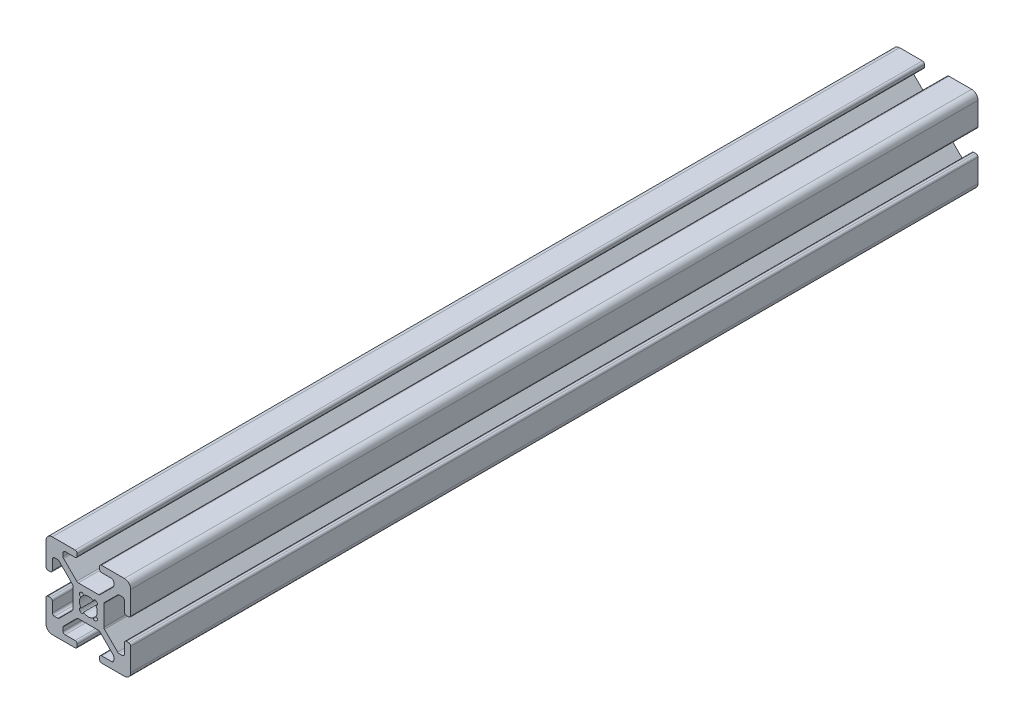
from build123d import *

# Parameters (mm, degrees)
F_2020_PROFILE_DEPTH = 100


with BuildPart() as part:
    # Sketch1 → 2020 Profile (new, symmetric)
    with BuildSketch(Plane.XY):
        with BuildLine():
            Line((-3.655, 0), (-3.655, 2.383919339))
            ThreePointArc((-3.655, 2.383919339), (-3.693669197, 2.578322522), (-3.803789755, 2.743129583))
            Line((-3.803789755, 2.743129583), (-6.906870417, 5.846210245))
            ThreePointArc((-6.906870417, 5.846210245), (-7.071677478, 5.956330803), (-7.266080661, 5.995))
            Line((-7.266080661, 5.995), (-7.992, 5.995))
            ThreePointArc((-7.992, 5.995), (-8.351210245, 5.846210245), (-8.5, 5.487))
            Line((-8.5, 5.487), (-8.5, 3.138))
            ThreePointArc((-8.5, 3.138), (-8.648789755, 2.778789755), (-9.008, 2.63))
            Line((-9.008, 2.63), (-9.492, 2.63))
            ThreePointArc((-9.492, 2.63), (-9.851210245, 2.778789755), (-10, 3.138))
            Line((-10, 3.138), (-10, 8.5))
            ThreePointArc((-10, 8.5), (-9.560660172, 9.560660172), (-8.5, 10))
            Line((-8.5, 10), (-3.138, 10))
            ThreePointArc((-3.138, 10), (-2.778789755, 9.851210245), (-2.63, 9.492))
            Line((-2.63, 9.492), (-2.63, 9.008))
            ThreePointArc((-2.63, 9.008), (-2.778789755, 8.648789755), (-3.138, 8.5))
            Line((-3.138, 8.5), (-5.487, 8.5))
            ThreePointArc((-5.487, 8.5), (-5.846210245, 8.351210245), (-5.995, 7.992))
            Line((-5.995, 7.992), (-5.995, 7.266080661))
            ThreePointArc((-5.995, 7.266080661), (-5.956330803, 7.071677478), (-5.846210245, 6.906870417))
            Line((-5.846210245, 6.906870417), (-2.743129583, 3.803789755))
            ThreePointArc((-2.743129583, 3.803789755), (-2.578322522, 3.693669197), (-2.383919339, 3.655))
            Line((-2.383919339, 3.655), (0, 3.655))
            Line((0, 3.655), (2.383919339, 3.655))
            ThreePointArc((2.383919339, 3.655), (2.578322522, 3.693669197), (2.743129583, 3.803789755))
            Line((2.743129583, 3.803789755), (5.846210245, 6.906870417))
            ThreePointArc((5.846210245, 6.906870417), (5.956330803, 7.071677478), (5.995, 7.266080661))
            Line((5.995, 7.266080661), (5.995, 7.992))
            ThreePointArc((5.995, 7.992), (5.846210245, 8.351210245), (5.487, 8.5))
            Line((5.487, 8.5), (3.138, 8.5))
            ThreePointArc((3.138, 8.5), (2.778789755, 8.648789755), (2.63, 9.008))
            Line((2.63, 9.008), (2.63, 9.492))
            ThreePointArc((2.63, 9.492), (2.778789755, 9.851210245), (3.138, 10))
            Line((3.138, 10), (8.5, 10))
            ThreePointArc((8.5, 10), (9.560660172, 9.560660172), (10, 8.5))
            Line((10, 8.5), (10, 3.138))
            ThreePointArc((10, 3.138), (9.851210245, 2.778789755), (9.492, 2.63))
            Line((9.492, 2.63), (9.008, 2.63))
            ThreePointArc((9.008, 2.63), (8.648789755, 2.778789755), (8.5, 3.138))
            Line((8.5, 3.138), (8.5, 5.487))
            ThreePointArc((8.5, 5.487), (8.351210245, 5.846210245), (7.992, 5.995))
            Line((7.992, 5.995), (7.266080661, 5.995))
            ThreePointArc((7.266080661, 5.995), (7.071677478, 5.956330803), (6.906870417, 5.846210245))
            Line((6.906870417, 5.846210245), (3.803789755, 2.743129583))
            ThreePointArc((3.803789755, 2.743129583), (3.693669197, 2.578322522), (3.655, 2.383919339))
            Line((3.655, 2.383919339), (3.655, 0))
            Line((3.655, 0), (3.655, -2.383919339))
            ThreePointArc((3.655, -2.383919339), (3.693669197, -2.578322522), (3.803789755, -2.743129583))
            Line((3.803789755, -2.743129583), (6.906870417, -5.846210245))
            ThreePointArc((6.906870417, -5.846210245), (7.071677478, -5.956330803), (7.266080661, -5.995))
            Line((7.266080661, -5.995), (7.992, -5.995))
            ThreePointArc((7.992, -5.995), (8.351210245, -5.846210245), (8.5, -5.487))
            Line((8.5, -5.487), (8.5, -3.138))
            ThreePointArc((8.5, -3.138), (8.648789755, -2.778789755), (9.008, -2.63))
            Line((9.008, -2.63), (9.492, -2.63))
            ThreePointArc((9.492, -2.63), (9.851210245, -2.778789755), (10, -3.138))
            Line((10, -3.138), (10, -8.5))
            ThreePointArc((10, -8.5), (9.560660172, -9.560660172), (8.5, -10))
            Line((8.5, -10), (3.138, -10))
            ThreePointArc((3.138, -10), (2.778789755, -9.851210245), (2.63, -9.492))
            Line((2.63, -9.492), (2.63, -9.008))
            ThreePointArc((2.63, -9.008), (2.778789755, -8.648789755), (3.138, -8.5))
            Line((3.138, -8.5), (5.487, -8.5))
            ThreePointArc((5.487, -8.5), (5.846210245, -8.351210245), (5.995, -7.992))
            Line((5.995, -7.992), (5.995, -7.266080661))
            ThreePointArc((5.995, -7.266080661), (5.956330803, -7.071677478), (5.846210245, -6.906870417))
            Line((5.846210245, -6.906870417), (2.743129583, -3.803789755))
            ThreePointArc((2.743129583, -3.803789755), (2.578322522, -3.693669197), (2.383919339, -3.655))
            Line((2.383919339, -3.655), (0, -3.655))
            Line((0, -3.655), (-2.383919339, -3.655))
            ThreePointArc((-2.383919339, -3.655), (-2.578322522, -3.693669197), (-2.743129583, -3.803789755))
            Line((-2.743129583, -3.803789755), (-5.846210245, -6.906870417))
            ThreePointArc((-5.846210245, -6.906870417), (-5.956330803, -7.071677478), (-5.995, -7.266080661))
            Line((-5.995, -7.266080661), (-5.995, -7.992))
            ThreePointArc((-5.995, -7.992), (-5.846210245, -8.351210245), (-5.487, -8.5))
            Line((-5.487, -8.5), (-3.138, -8.5))
            ThreePointArc((-3.138, -8.5), (-2.778789755, -8.648789755), (-2.63, -9.008))
            Line((-2.63, -9.008), (-2.63, -9.492))
            ThreePointArc((-2.63, -9.492), (-2.778789755, -9.851210245), (-3.138, -10))
            Line((-3.138, -10), (-8.5, -10))
            ThreePointArc((-8.5, -10), (-9.560660172, -9.560660172), (-10, -8.5))
            Line((-10, -8.5), (-10, -3.138))
            ThreePointArc((-10, -3.138), (-9.851210245, -2.778789755), (-9.492, -2.63))
            Line((-9.492, -2.63), (-9.008, -2.63))
            ThreePointArc((-9.008, -2.63), (-8.648789755, -2.778789755), (-8.5, -3.138))
            Line((-8.5, -3.138), (-8.5, -5.487))
            ThreePointArc((-8.5, -5.487), (-8.351210245, -5.846210245), (-7.992, -5.995))
            Line((-7.992, -5.995), (-7.266080661, -5.995))
            ThreePointArc((-7.266080661, -5.995), (-7.071677478, -5.956330803), (-6.906870417, -5.846210245))
            Line((-6.906870417, -5.846210245), (-3.803789755, -2.743129583))
            ThreePointArc((-3.803789755, -2.743129583), (-3.693669197, -2.578322522), (-3.655, -2.383919339))
            Line((-3.655, -2.383919339), (-3.655, 0))
        make_face()
        with BuildLine():
            Line((-2.028687234, 1.848687546), (-1.848687546, 2.028687234))
            ThreePointArc((-1.848687546, 2.028687234), (-1.412354366, 2.11078896), (-1.177278935, 1.734136762))
            ThreePointArc((-1.177278935, 1.734136762), (-0.615818702, 2.003492782), (0, 2.096))
            ThreePointArc((0, 2.096), (0.615818702, 2.003492782), (1.177278935, 1.734136762))
            ThreePointArc((1.177278935, 1.734136762), (1.412354366, 2.11078896), (1.848687546, 2.028687234))
            Line((1.848687546, 2.028687234), (2.028687234, 1.848687546))
            ThreePointArc((2.028687234, 1.848687546), (2.11078896, 1.412354366), (1.734136762, 1.177278935))
            ThreePointArc((1.734136762, 1.177278935), (2.003492782, 0.615818702), (2.096, 0))
            ThreePointArc((2.096, 0), (2.003492782, -0.615818702), (1.734136762, -1.177278935))
            ThreePointArc((1.734136762, -1.177278935), (2.11078896, -1.412354366), (2.028687234, -1.848687546))
            Line((2.028687234, -1.848687546), (1.848687546, -2.028687234))
            ThreePointArc((1.848687546, -2.028687234), (1.412354366, -2.11078896), (1.177278935, -1.734136762))
            ThreePointArc((1.177278935, -1.734136762), (0.615818702, -2.003492782), (0, -2.096))
            ThreePointArc((0, -2.096), (-0.615818702, -2.003492782), (-1.177278935, -1.734136762))
            ThreePointArc((-1.177278935, -1.734136762), (-1.412354366, -2.11078896), (-1.848687546, -2.028687234))
            Line((-1.848687546, -2.028687234), (-2.028687234, -1.848687546))
            ThreePointArc((-2.028687234, -1.848687546), (-2.11078896, -1.412354366), (-1.734136762, -1.177278935))
            ThreePointArc((-1.734136762, -1.177278935), (-2.003492782, -0.615818702), (-2.096, 0))
            ThreePointArc((-2.096, 0), (-2.003492782, 0.615818702), (-1.734136762, 1.177278935))
            ThreePointArc((-1.734136762, 1.177278935), (-2.11078896, 1.412354366), (-2.028687234, 1.848687546))
        make_face(mode=Mode.SUBTRACT)
    extrude(amount=F_2020_PROFILE_DEPTH, both=True)


solid = part.part
